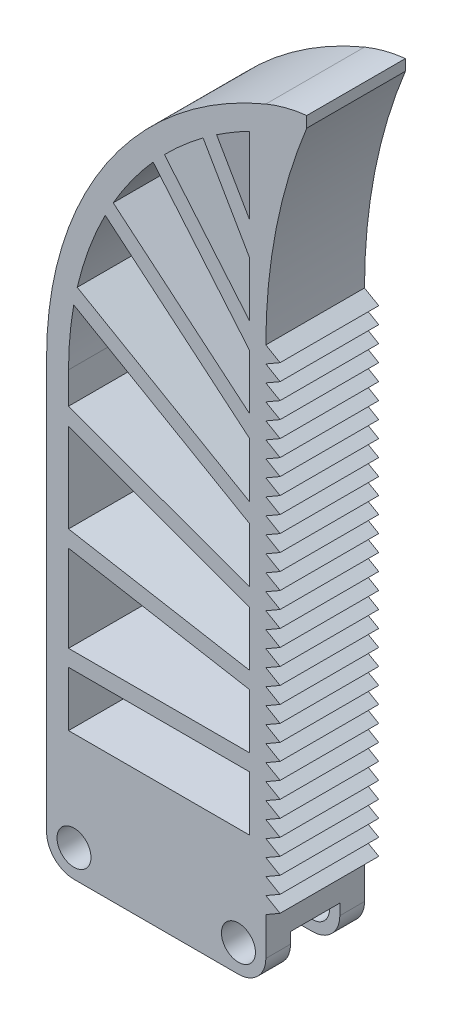
from build123d import *

# Parameters (mm, degrees)
BOSS_EXTRUDE1_DEPTH     = 18
SKETCH3_W               = 33
SKETCH3_H               = 10
CUT_EXTRUDE1_DEPTH      = 143.562267098
CUT_EXTRUDE2_DEPTH      = 143.562267098
CUT_EXTRUDE3_DEPTH      = 143.562267098
CUT_EXTRUDE4_DEPTH      = 143.562267098
BOSS_EXTRUDE2_DEPTH     = 18
BOSS_EXTRUDE3_DEPTH     = 18
LPATTERN1_COUNT         = 30
LPATTERN1_PITCH         = 3
CUT_EXTRUDE5_DEPTH      = 146.668613805
CUT_EXTRUDE6_DEPTH      = 146.668613805
CUT_EXTRUDE7_DEPTH      = 146.668613805
CUT_EXTRUDE8_DEPTH      = 146.668613805
CUT_EXTRUDE9_DEPTH      = 4.5
CUT_EXTRUDE9_DEPTH_BACK = 4.5
FILLET1_R               = 5
F_6_0_MM_DOWEL_HOLES1_D = 6.2


with BuildPart() as part:
    # Sketch2 → Boss-Extrude1 (new body)
    with BuildSketch(Plane.XY):
        with BuildLine():
            Line((-20, 0), (20, 0))
            Line((20, 0), (20, 140))
            ThreePointArc((20, 140), (-9.083269132, 116.055512755), (-20, 80))
            Line((-20, 80), (-20, 0))
        make_face()
    extrude(amount=BOSS_EXTRUDE1_DEPTH)

    # Sketch3 → Cut-Extrude1 (cut, through all)
    with BuildSketch(Plane.XY.offset(18)):
        with Locations((0.5, 28)):
            Rectangle(SKETCH3_W, SKETCH3_H)
    extrude(amount=-CUT_EXTRUDE1_DEPTH, mode=Mode.SUBTRACT)

    # Sketch4 → Cut-Extrude2 (cut, through all)
    with BuildSketch(Plane.XY.offset(18)):
        Polygon((-16, 36), (17, 36), (17, 46), (-16, 51.818790363), align=None)
    extrude(amount=-CUT_EXTRUDE2_DEPTH, mode=Mode.SUBTRACT)

    # Sketch5 → Cut-Extrude3 (cut, through all)
    with BuildSketch(Plane.XY.offset(18)):
        Polygon((-16, 54.865070199), (17, 49.046279836), (17, 59.046279836), (-16, 71.057297566), align=None)
    extrude(amount=-CUT_EXTRUDE3_DEPTH, mode=Mode.SUBTRACT)

    # Sketch6 → Cut-Extrude4 (cut, through all)
    with BuildSketch(Plane.XY.offset(18)):
        with BuildLine():
            Line((-16, 74.249830884), (17, 62.238813153))
            Line((17, 62.238813153), (17, 72.238813153))
            Line((17, 72.238813153), (-15.046889298, 90.741093316))
            ThreePointArc((-15.046889298, 90.741093316), (-15.761255119, 85.391648765), (-16, 80))
            Line((-16, 80), (-16, 74.249830884))
        make_face()
    extrude(amount=-CUT_EXTRUDE4_DEPTH, mode=Mode.SUBTRACT)

    # Sketch13 → Boss-Extrude2 (add)
    with BuildSketch(Plane.XY.offset(18)):
        with BuildLine():
            Line((27.463865989, 141.919276749), (27.463865989, 139.919276749))
            ThreePointArc((27.463865989, 139.919276749), (21.883638711, 121.290161062), (20, 101.934676234))
            Line((20, 101.934676234), (20, 140))
            ThreePointArc((20, 140), (23.663152719, 141.227117654), (27.463865989, 141.919276749))
        make_face()
    extrude(amount=-BOSS_EXTRUDE2_DEPTH)

    # Sketch15 → Boss-Extrude3 (add)
    with BuildSketch(Plane.XY.offset(18)):
        Polygon((20, 101.934676234), (22.598076211, 100.434676234), (20, 98.934676234), align=None)
    boss_extrude3 = extrude(amount=-BOSS_EXTRUDE3_DEPTH)

    # LPattern1: Boss-Extrude3 ×30
    with Locations(*[(0, -i * LPATTERN1_PITCH, 0) for i in range(1, LPATTERN1_COUNT)]):
        add(boss_extrude3)

    # Sketch17 → Cut-Extrude5 (cut, through all)
    with BuildSketch(Plane.XY.offset(18)):
        with BuildLine():
            Line((-14.409820926, 93.837383335), (17, 75.702914768))
            Line((17, 75.702914768), (17, 85.702914768))
            Line((17, 85.702914768), (-9.308172311, 107.778092451))
            ThreePointArc((-9.308172311, 107.778092451), (-12.284651864, 100.963507838), (-14.409820926, 93.837383335))
        make_face()
    extrude(amount=-CUT_EXTRUDE5_DEPTH, mode=Mode.SUBTRACT)

    # Sketch18 → Cut-Extrude6 (cut, through all)
    with BuildSketch(Plane.XY.offset(18)):
        with BuildLine():
            Line((-7.846238812, 110.46760646), (17, 89.619136636))
            Line((17, 89.619136636), (17, 99.619136636))
            Line((17, 99.619136636), (-0.566824758, 120.554463152))
            ThreePointArc((-0.566824758, 120.554463152), (-4.464319866, 115.697073553), (-7.846238812, 110.46760646))
        make_face()
    extrude(amount=-CUT_EXTRUDE6_DEPTH, mode=Mode.SUBTRACT)

    # Sketch19 → Cut-Extrude7 (cut, through all)
    with BuildSketch(Plane.XY.offset(18)):
        with BuildLine():
            Line((1.497556464, 122.761400894), (17, 104.286308117))
            Line((17, 104.286308117), (17, 114.286308117))
            Line((17, 114.286308117), (8.554035532, 128.915147695))
            ThreePointArc((8.554035532, 128.915147695), (4.907555132, 125.973860666), (1.497556464, 122.761400894))
        make_face()
    extrude(amount=-CUT_EXTRUDE7_DEPTH, mode=Mode.SUBTRACT)

    # Sketch21 → Cut-Extrude8 (cut, through all)
    with BuildSketch(Plane.XY.offset(18)):
        with BuildLine():
            Line((11.013641865, 130.654984559), (17, 120.286308117))
            Line((17, 120.286308117), (17, 134.194095619))
            ThreePointArc((17, 134.194095619), (13.956345649, 132.509918344), (11.013641865, 130.654984559))
        make_face()
    extrude(amount=-CUT_EXTRUDE8_DEPTH, mode=Mode.SUBTRACT)

    # Sketch25 → Cut-Extrude9 (cut, two sides: drawn at the far end of the back side and taken through both)
    with BuildSketch(Plane(origin=(0, 0, 9), x_dir=(-1, 0, 0), z_dir=(0, 0, -1)).offset(-CUT_EXTRUDE9_DEPTH_BACK)):
        with BuildLine():
            Line((-20, 0), (-20, 7))
            Line((-20, 7), (-17, 7))
            ThreePointArc((-17, 7), (-14.171572875, 5.828427125), (-13, 3))
            Line((-13, 3), (-13, 0))
            Line((-13, 0), (-20, 0))
        make_face()
    extrude(amount=CUT_EXTRUDE9_DEPTH + CUT_EXTRUDE9_DEPTH_BACK, mode=Mode.SUBTRACT)

    # Fillet1
    fillet1_edges = [part.edges().sort_by_distance(p)[0] for p in [
        (20, 0, 2.25),
        (20, 0, 15.75),
        (-20, 0, 9),
    ]]
    fillet(fillet1_edges, radius=FILLET1_R)

    # Ø6.0 mm Dowel Holes1 (through all)
    with Locations(Plane.XY.offset(18)):
        with Locations((-15, 5)):
            f_6_0_mm_dowel_holes1 = Hole(F_6_0_MM_DOWEL_HOLES1_D / 2)

    # Mirror1: Ø6.0 mm Dowel Holes1 across plane
    add(f_6_0_mm_dowel_holes1.mirror(Plane(origin=(0, 0, 0), x_dir=(0, 0, 1), z_dir=(1, 0, 0))), mode=Mode.SUBTRACT)


solid = part.part
